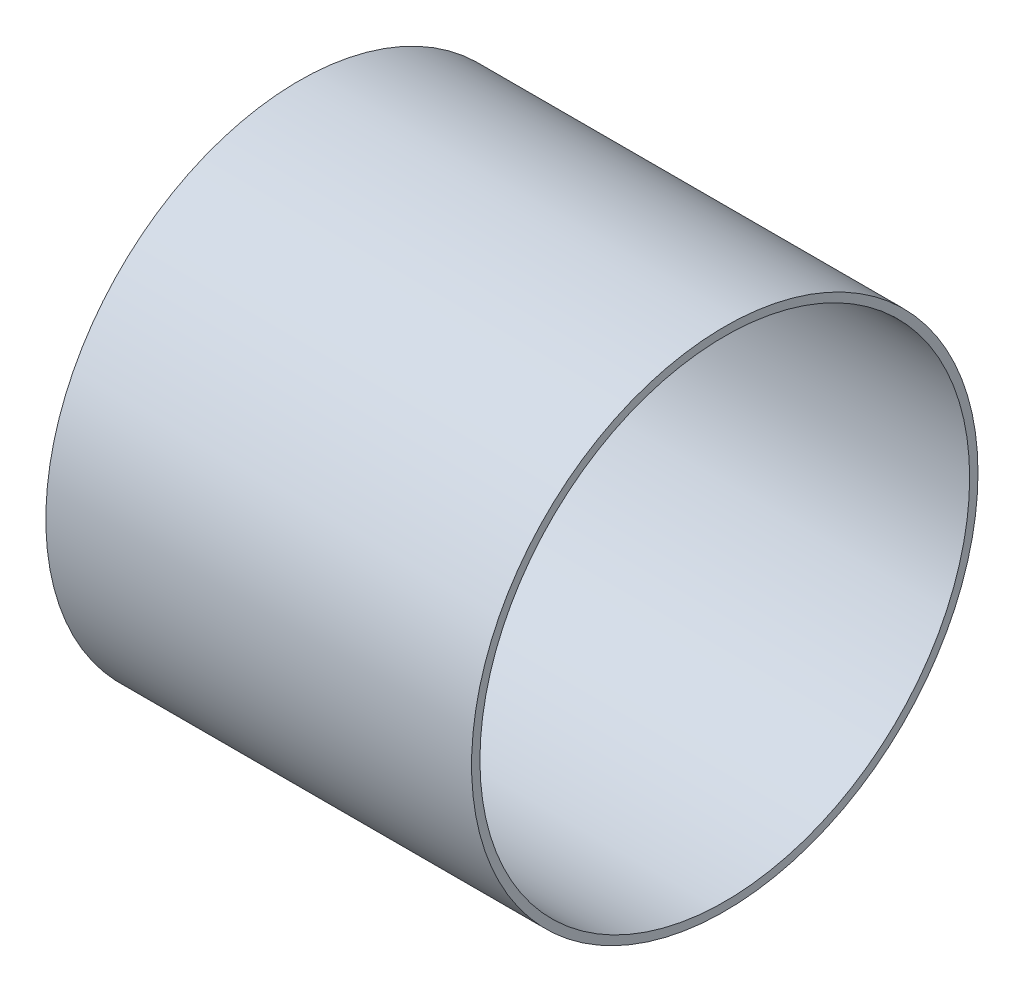
from build123d import *

# Parameters (mm, degrees)
SKETCH1_R           = 45.5
SKETCH1_R_2         = 44
BOSS_EXTRUDE1_DEPTH = 38.25


with BuildPart() as part:
    # Sketch1 → Boss-Extrude1 (new, symmetric)
    with BuildSketch(Plane(origin=(0, 0, 0), x_dir=(0, 0, -1), z_dir=(1, 0, 0))):
        Circle(SKETCH1_R)
        Circle(SKETCH1_R_2, mode=Mode.SUBTRACT)
    extrude(amount=BOSS_EXTRUDE1_DEPTH, both=True)


solid = part.part
